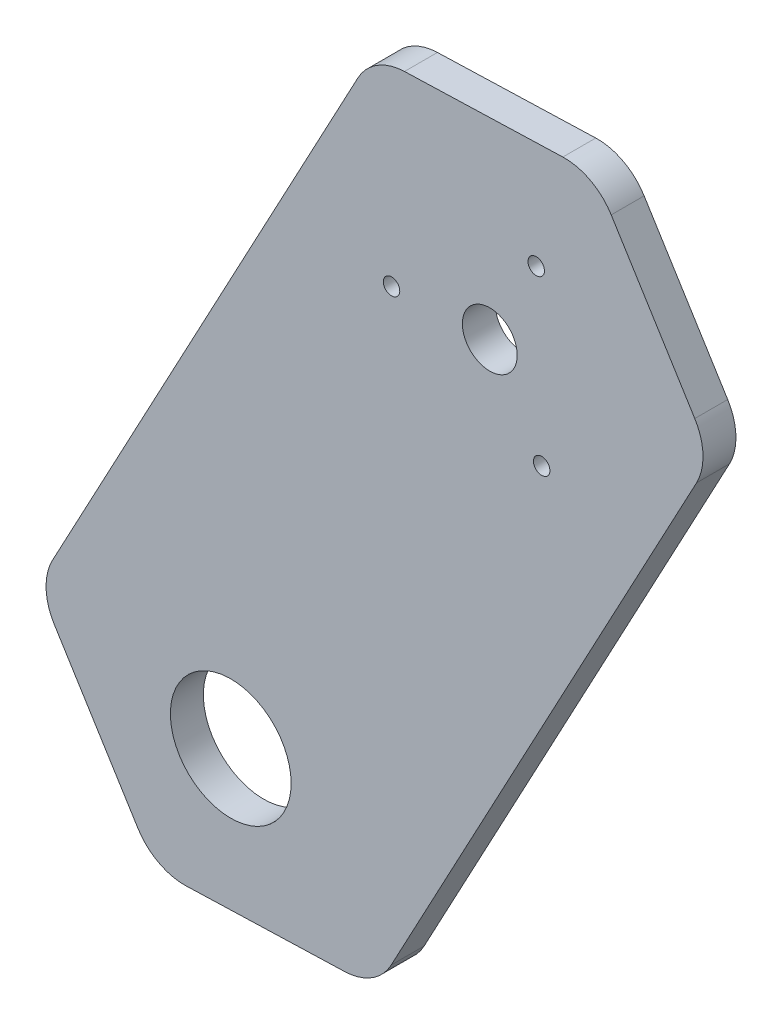
from build123d import *

# Parameters (mm, degrees)
SKETCH1_R           = 1.5
SKETCH1_R_2         = 5
SKETCH1_R_3         = 11
BOSS_EXTRUDE1_DEPTH = 6


with BuildPart() as part:
    # Sketch1 → Boss-Extrude1 (new body)
    with BuildSketch(Plane.XY):
        with BuildLine():
            Line((-15.825032692, 248.9866097), (-31.051372458, 273.511941719))
            ThreePointArc((-31.051372458, 273.511941719), (-32.550427247, 278.46651072), (-31.371362275, 283.506820734))
            Line((-31.371362275, 283.506820734), (24.265878158, 387.41662877))
            ThreePointArc((24.265878158, 387.41662877), (27.807133383, 391.192132799), (32.761702384, 392.691187588))
            Line((32.761702384, 392.691187588), (61.614432832, 393.614918623))
            ThreePointArc((61.614432832, 393.614918623), (66.654742845, 392.435853651), (70.430246875, 388.894598426))
            Line((70.430246875, 388.894598426), (85.656586641, 364.369266407))
            ThreePointArc((85.656586641, 364.369266407), (87.15564143, 359.414697406), (85.976576458, 354.374387393))
            Line((85.976576458, 354.374387393), (30.339336025, 250.464579356))
            ThreePointArc((30.339336025, 250.464579356), (26.7980808, 246.689075327), (21.843511799, 245.190020539))
            Line((21.843511799, 245.190020539), (-7.009218649, 244.266289503))
            ThreePointArc((-7.009218649, 244.266289503), (-12.049528662, 245.445354475), (-15.825032692, 248.9866097))
        make_face()
        with Locations((56.765475088, 373.966355411)):
            Circle(SKETCH1_R, mode=Mode.SUBTRACT)
        with Locations((57.758509759, 342.948926532)):
            Circle(SKETCH1_R, mode=Mode.SUBTRACT)
        with Locations((30.400111055, 357.59764772)):
            Circle(SKETCH1_R, mode=Mode.SUBTRACT)
        with Locations((48.308031967, 358.170976554)):
            Circle(SKETCH1_R_2, mode=Mode.SUBTRACT)
        with Locations((1.104829999, 270.012836125)):
            Circle(SKETCH1_R_3, mode=Mode.SUBTRACT)
    extrude(amount=BOSS_EXTRUDE1_DEPTH)


solid = part.part
